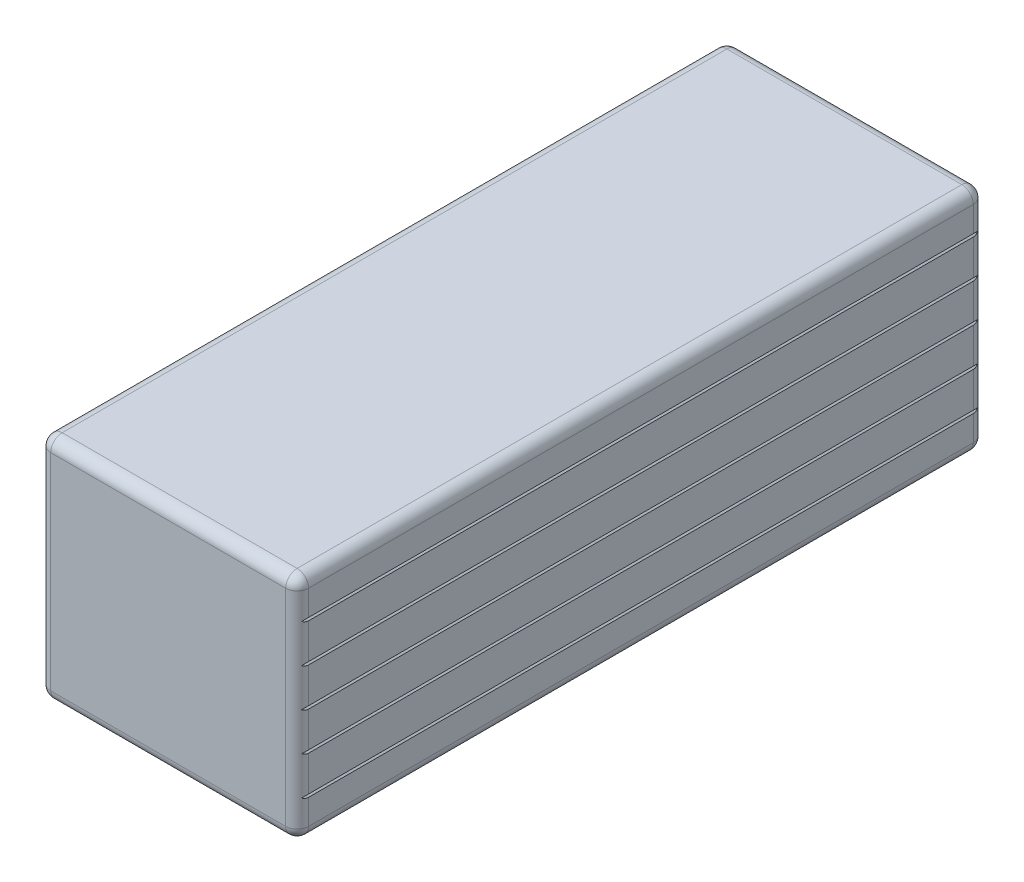
from build123d import *

# Parameters (mm, degrees)
SKETCH1_W           = 45
SKETCH1_H           = 40
BOSS_EXTRUDE1_DEPTH = 120
FILLET1_R           = 2
CUT_EXTRUDE1_DEPTH  = 124.718430317
LPATTERN1_COUNT     = 5
LPATTERN1_PITCH     = 6.67


with BuildPart() as part:
    # Sketch1 → Boss-Extrude1 (new body)
    with BuildSketch(Plane.XY):
        Rectangle(SKETCH1_W, SKETCH1_H)
    extrude(amount=-BOSS_EXTRUDE1_DEPTH)

    # Fillet1
    fillet1_edges = [part.edges().sort_by_distance(p)[0] for p in [
        (22.5, 0, -120),
        (0, 20, -120),
        (-22.5, 0, -120),
        (0, 20, 0),
        (22.5, 0, 0),
        (0, -20, 0),
        (-22.5, 0, 0),
        (-22.5, 20, -60),
        (22.5, 20, -60),
        (22.5, -20, -60),
        (-22.5, -20, -60),
        (0, -20, -120),
    ]]
    fillet(fillet1_edges, radius=FILLET1_R)

    # Sketch2 → Cut-Extrude1 (cut, symmetric)
    with BuildSketch(Plane.XY):
        Polygon((22.5, 13.58), (22.25, 13.33), (22.5, 13.08), align=None)
        Polygon((-22.5, 13.58), (-22.25, 13.33), (-22.5, 13.08), align=None)
    cut_extrude1 = extrude(amount=CUT_EXTRUDE1_DEPTH, both=True, mode=Mode.SUBTRACT)

    # LPattern1: Cut-Extrude1 ×5
    with Locations(*[(0, -i * LPATTERN1_PITCH, 0) for i in range(1, LPATTERN1_COUNT)]):
        add(cut_extrude1, mode=Mode.SUBTRACT)


solid = part.part
